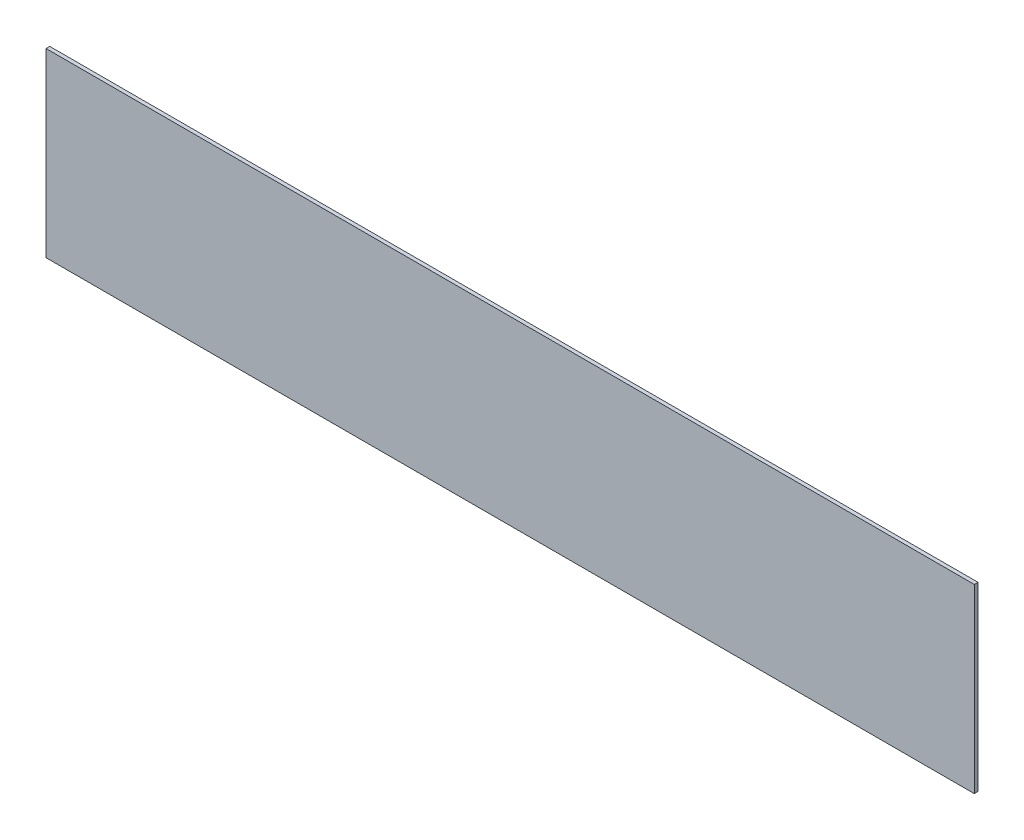
from build123d import *

# Parameters (mm, degrees)
SKETCH1_W           = 251.04
SKETCH1_H           = 49
BOSS_EXTRUDE1_DEPTH = 1


with BuildPart() as part:
    # Sketch1 → Boss-Extrude1 (new body)
    with BuildSketch(Plane.XY):
        with Locations((125.52, 24.5)):
            Rectangle(SKETCH1_W, SKETCH1_H)
    extrude(amount=BOSS_EXTRUDE1_DEPTH)


solid = part.part
